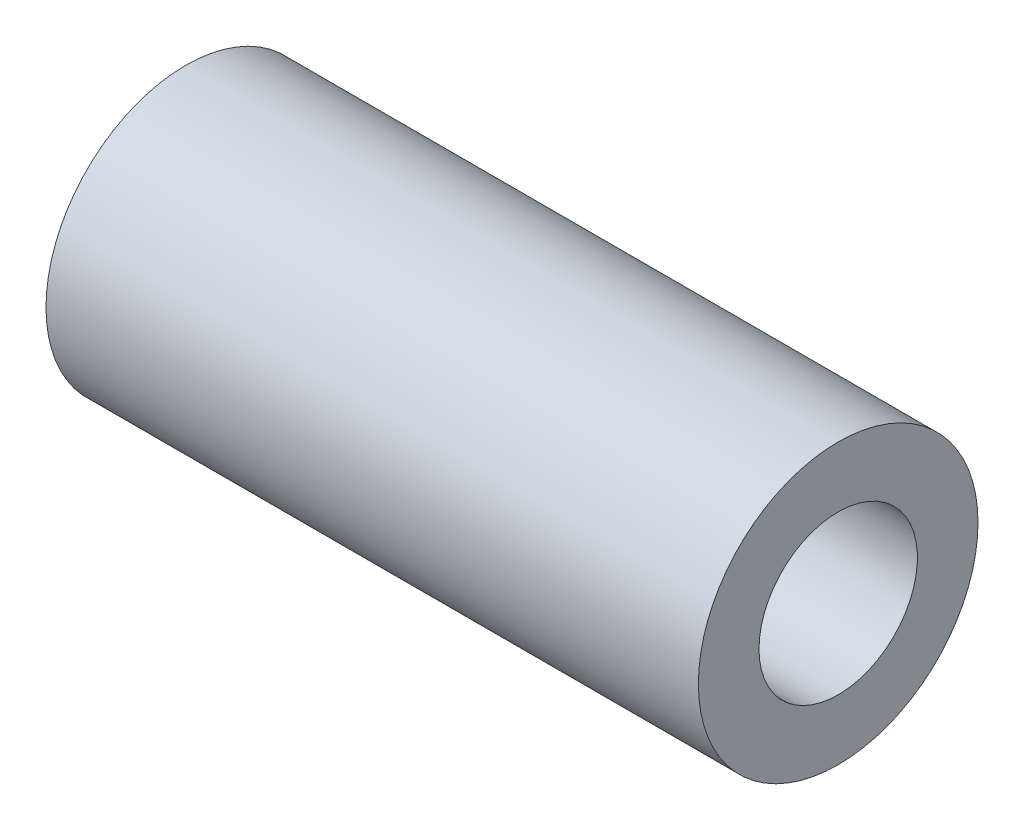
from build123d import *

# Parameters (mm, degrees)
AXIAL_BLANK_PROFILE_W = 14
AXIAL_BLANK_PROFILE_H = 1.3


with BuildPart() as part:
    # Axial blank profile → Native revolved blank (revolve)
    with BuildSketch(Plane.XY, mode=Mode.PRIVATE) as native_revolved_blank_sk:
        with Locations((-10, 2.35)):
            Rectangle(AXIAL_BLANK_PROFILE_W, AXIAL_BLANK_PROFILE_H)
    revolve(native_revolved_blank_sk.sketch.rotate(Axis((-60, 0, 0), (1, 0, 0)), 90), axis=Axis((-60, 0, 0), (1, 0, 0)))


solid = part.part
